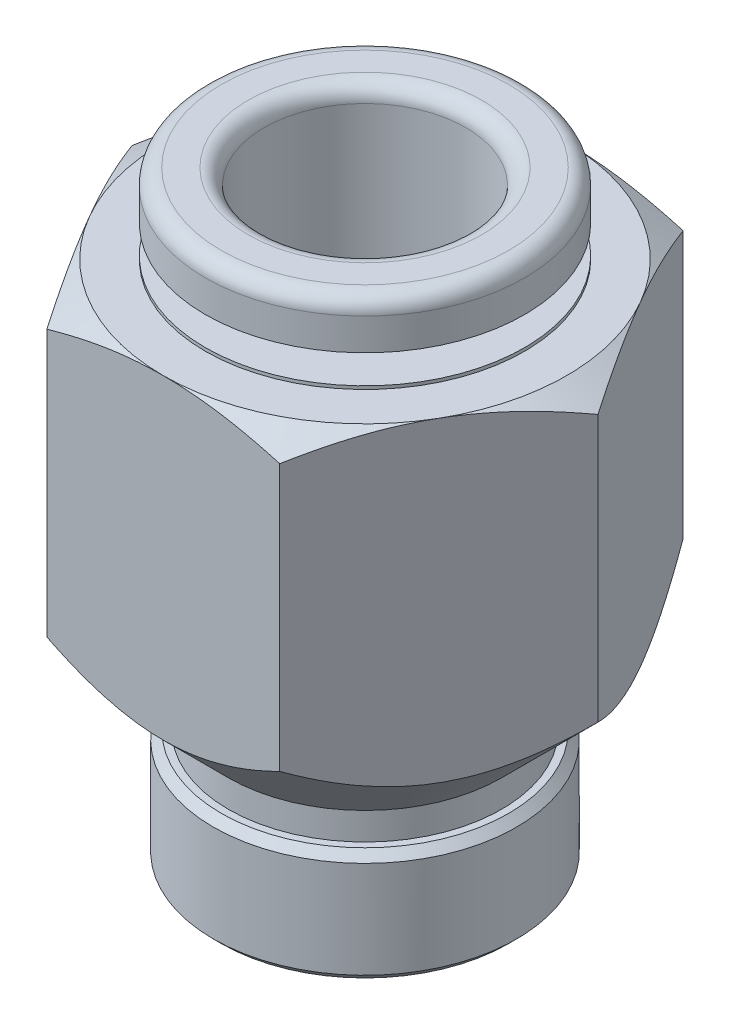
from build123d import *

# Parameters (mm, degrees)
UBODY_START         = -0.1
UBODY_SKETCH_R      = 5.025
UBODY_DEPTH         = 0.1
NUT_DEPTH           = 11.99
THREAD_CHAMFER_SIZE = 0.25
UTUBE_START         = -13.3
UTUBE_SKETCH_R      = 3.175
UTUBE_DEPTH         = 13.3
UTUBE_RADIUS_R      = 0.5
PORT_SKETCH_R       = 1.984375
PORT_DEPTH          = 22.243724564


with BuildPart() as part:
    # URelease_Sketch → URelease (revolve)
    with BuildSketch(Plane.XY, mode=Mode.PRIVATE) as urelease_sk:
        with BuildLine():
            Line((0, 0), (-4.525, 0))
            ThreePointArc((-4.525, 0), (-4.878553391, -0.146446609), (-5.025, -0.5))
            Line((-5.025, -0.5), (-5.025, -1.5))
            Line((-5.025, -1.5), (-3.575, -1.5))
            Line((-3.575, -1.5), (-3.575, -2.4))
            Line((-3.575, -2.4), (0, -2.4))
            Line((0, -2.4), (0, 0))
        make_face()
    revolve(urelease_sk.sketch.rotate(Axis((0, 0, 0), (0, -1, 0)), 270), axis=Axis((0, 0, 0), (0, -1, 0)))

    # UBody_Sketch → UBody (add)
    with BuildSketch(Plane(origin=(0, -2.4, 0), x_dir=(-1, 0, 0), z_dir=(0, 1, 0)).offset(UBODY_START)):
        with Locations(Location((0, 0, 0), (0, 0, 90))):
            Circle(UBODY_SKETCH_R)
    extrude(amount=UBODY_DEPTH)

    # Nut_Sketch → Nut (add)
    with BuildSketch(Plane(origin=(0, -2.5, 0), x_dir=(-1, 0, 0), z_dir=(0, 1, 0))):
        Polygon((-3.666174209, -6.35), (3.666174209, -6.35), (7.332348419, 0), (3.666174209, 6.35), (-3.666174209, 6.35), (-7.332348419, 0), align=None)
    extrude(amount=-NUT_DEPTH)

    # Nut_Chamfer_Sketch → Nut_Chamfer (revolve, cut)
    with BuildSketch(Plane(origin=(0, 0, 0), x_dir=(0, 0, -1), z_dir=(1, 0, 0))):
        Polygon((-6.35, -2.5), (-9.35, -2.5), (-9.35, -4.232050808), align=None)
        Polygon((-9.35, -12.757949192), (-9.35, -14.49), (-6.35, -14.49), align=None)
    revolve(axis=Axis((0, 0, 0), (0, -1, 0)), mode=Mode.SUBTRACT)

    # Threads_Sketch → Threads (revolve)
    with BuildSketch(Plane.XY, mode=Mode.PRIVATE) as threads_sk:
        Polygon((-4.7715, -15.35), (-4.3, -15.35), (-4.3, -14.49), (0, -14.49), (0, -18.9), (-4.7715, -18.9), align=None)
    revolve(threads_sk.sketch.rotate(Axis((0, 0, 0), (0, -1, 0)), 270), axis=Axis((0, 0, 0), (0, -1, 0)))

    # Thread_Chamfer
    thread_chamfer_edges = [part.edges().sort_by_distance(p)[0] for p in [
        (0, -18.9, -4.7715),
        (0, -15.35, -4.7715),
    ]]
    chamfer(thread_chamfer_edges, length=THREAD_CHAMFER_SIZE)

    # UTube_Sketch → UTube (cut)
    with BuildSketch(Plane(origin=(0, 0, 0), x_dir=(1, 0, 0), z_dir=(0, 1, 0)).offset(UTUBE_START)):
        with Locations(Location((0, 0, 0), (0, 0, 270))):
            Circle(UTUBE_SKETCH_R)
    extrude(amount=UTUBE_DEPTH, mode=Mode.SUBTRACT)

    # UTube_Radius
    utube_radius_edges = [part.edges().sort_by_distance(p)[0] for p in [
        (0, 0, -3.175),
    ]]
    fillet(utube_radius_edges, radius=UTUBE_RADIUS_R)

    # Port_Sketch → Port (cut, through all)
    with BuildSketch(Plane(origin=(0, 0, 0), x_dir=(1, 0, 0), z_dir=(0, 1, 0))):
        with Locations(Location((0, 0, 0), (0, 0, 270))):
            Circle(PORT_SKETCH_R)
    extrude(amount=-PORT_DEPTH, mode=Mode.SUBTRACT)

    # Sketch1 → Cut-Revolve2 (revolve, cut)
    with BuildSketch(Plane.XY, mode=Mode.PRIVATE) as cut_revolve2_sk:
        Polygon((-4.3, -14.49), (-7.332348419, -11.457651581), (-7.332348419, -14.49), align=None)
    revolve(cut_revolve2_sk.sketch.rotate(Axis((0, -18.9, 0), (0, 1, 0)), 270), axis=Axis((0, -18.9, 0), (0, 1, 0)), mode=Mode.SUBTRACT)


solid = part.part
